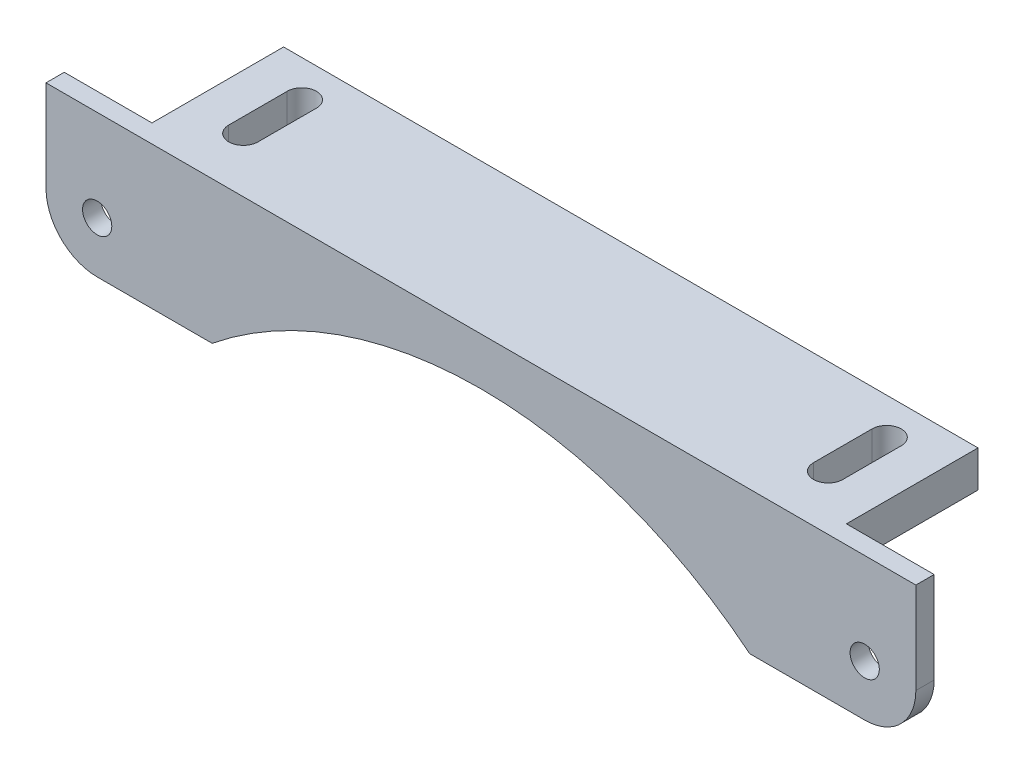
from build123d import *

# Parameters (mm, degrees)
SKETCH1_W           = 95
SKETCH1_H           = 18
BOSS_EXTRUDE1_DEPTH = 5
SKETCH2_R           = 2
SKETCH2_W           = 95
SKETCH2_H           = 5
BOSS_EXTRUDE2_DEPTH = 2.5


with BuildPart() as part:
    # Sketch1 → Boss-Extrude1 (new body)
    with BuildSketch(Plane(origin=(0, 0, 0), x_dir=(1, 0, 0), z_dir=(0, 1, 0))):
        Rectangle(SKETCH1_W, SKETCH1_H)
        with BuildLine():
            Line((-38, 4), (-38, -4))
            ThreePointArc((-38, -4), (-40, -6), (-42, -4))
            Line((-42, -4), (-42, 4))
            ThreePointArc((-42, 4), (-40, 6), (-38, 4))
        make_face(mode=Mode.SUBTRACT)
        with BuildLine():
            Line((42, 4), (42, -4))
            ThreePointArc((42, -4), (40, -6), (38, -4))
            Line((38, -4), (38, 4))
            ThreePointArc((38, 4), (40, 6), (42, 4))
        make_face(mode=Mode.SUBTRACT)
    extrude(amount=BOSS_EXTRUDE1_DEPTH)

    # Sketch2 → Boss-Extrude2 (add)
    # profile 1 of 2: a face of its own
    with BuildSketch(Plane.XY.offset(9)):
        with BuildLine():
            Line((-52.5, -14.5), (-36.769552622, -14.5))
            ThreePointArc((-36.769552622, -14.5), (0, -1.5), (36.769552622, -14.5))
            Line((36.769552622, -14.5), (52.5, -14.5))
            ThreePointArc((52.5, -14.5), (57.449747468, -12.449747468), (59.5, -7.5))
            Line((59.5, -7.5), (59.5, 5))
            Line((59.5, 5), (47.5, 5))
            Line((47.5, 5), (47.5, 0))
            Line((47.5, 0), (-47.5, 0))
            Line((-47.5, 0), (-47.5, 5))
            Line((-47.5, 5), (-59.5, 5))
            Line((-59.5, 5), (-59.5, -7.5))
            ThreePointArc((-59.5, -7.5), (-57.449747468, -12.449747468), (-52.5, -14.5))
        make_face()
        with Locations((-52.5, -7.5)):
            Circle(SKETCH2_R, mode=Mode.SUBTRACT)
        with Locations((52.5, -7.5)):
            Circle(SKETCH2_R, mode=Mode.SUBTRACT)
    # profile 2 of 2: a face of its own
    with BuildSketch(Plane.XY.offset(9)):
        with Locations((0, 2.5)):
            Rectangle(SKETCH2_W, SKETCH2_H)
    extrude(amount=BOSS_EXTRUDE2_DEPTH)


solid = part.part
